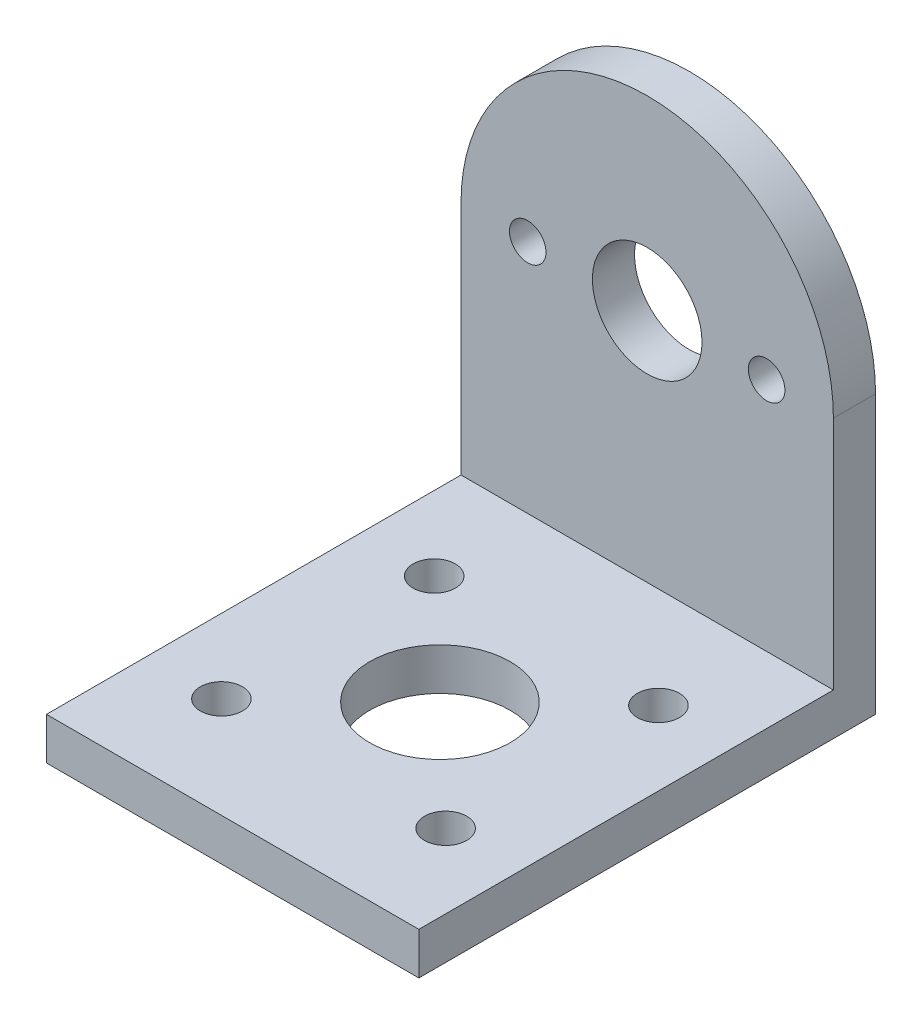
from build123d import *

# Parameters (mm, degrees)
SKETCH1_R           = 13.25
SKETCH1_R_2         = 1.3
SKETCH1_R_3         = 3.9
BOSS_EXTRUDE1_DEPTH = 3
BOSS_EXTRUDE2_DEPTH = 3


with BuildPart() as part:
    # Sketch1 → Boss-Extrude1 (new body)
    # profile 1 of 2: a face of its own
    with BuildSketch(Plane.XY):
        with Locations((0, 3.25)):
            Circle(SKETCH1_R)
        with Locations((8.5, 3.25)):
            Circle(SKETCH1_R_2, mode=Mode.SUBTRACT)
        with Locations((-8.5, 3.25)):
            Circle(SKETCH1_R_2, mode=Mode.SUBTRACT)
        with Locations((0, 3.25)):
            Circle(SKETCH1_R_3, mode=Mode.SUBTRACT)
    # profile 2 of 2: a face of its own
    with BuildSketch(Plane.XY):
        with BuildLine():
            Line((-13.25, 3.249999993), (-13.25, -16.5))
            Line((-13.25, -16.5), (13.25, -16.5))
            Line((13.25, -16.5), (13.25, 3.25))
            ThreePointArc((13.25, 3.25), (4e-09, -10), (-13.25, 3.249999993))
        make_face()
    extrude(amount=BOSS_EXTRUDE1_DEPTH)

    # Sketch2 → Boss-Extrude2 (add)
    with BuildSketch(Plane.XZ.offset(16.5)):
        with BuildLine():
            Line((0, 32.5), (-13.25, 32.5))
            Line((-13.25, 32.5), (-13.25, 3))
            Line((-13.25, 3), (0, 3))
            Line((0, 3), (0, 10.178644607))
            Line((0, 10.178644607), (-6.477335786, 10.178644607))
            ThreePointArc((-6.477335786, 10.178644607), (-9.037995958, 9.117984436), (-7.977335786, 11.678644607))
            Line((-7.977335786, 11.678644607), (-7.977335786, 23.821355393))
            ThreePointArc((-7.977335786, 23.821355393), (-9.037995958, 26.382015564), (-6.477335786, 25.321355393))
            Line((-6.477335786, 25.321355393), (0, 25.321355393))
            Line((0, 25.321355393), (0, 32.5))
        make_face()
        with BuildLine():
            Line((13.25, 32.5), (0, 32.5))
            Line((0, 32.5), (0, 25.321355393))
            Line((0, 25.321355393), (6.477335786, 25.321355393))
            ThreePointArc((6.477335786, 25.321355393), (7.977335786, 26.821355393), (9.477335786, 25.321355393))
            ThreePointArc((9.477335786, 25.321355393), (9.037995958, 24.260695221), (7.977335786, 23.821355393))
            Line((7.977335786, 23.821355393), (7.977335786, 11.678644607))
            ThreePointArc((7.977335786, 11.678644607), (9.037995958, 11.239304779), (9.477335786, 10.178644607))
            ThreePointArc((9.477335786, 10.178644607), (7.977335786, 8.678644607), (6.477335786, 10.178644607))
            Line((6.477335786, 10.178644607), (0, 10.178644607))
            Line((0, 10.178644607), (0, 3))
            Line((0, 3), (13.25, 3))
            Line((13.25, 3), (13.25, 32.5))
        make_face()
        with BuildLine():
            Line((6.477335786, 25.321355393), (0, 25.321355393))
            Line((0, 25.321355393), (0, 22.75))
            ThreePointArc((0, 22.75), (3.535533906, 21.285533906), (5, 17.75))
            ThreePointArc((5, 17.75), (3.535533906, 14.214466094), (0, 12.75))
            Line((0, 12.75), (0, 10.178644607))
            Line((0, 10.178644607), (6.477335786, 10.178644607))
            ThreePointArc((6.477335786, 10.178644607), (6.916675614, 11.239304779), (7.977335786, 11.678644607))
            Line((7.977335786, 11.678644607), (7.977335786, 23.821355393))
            ThreePointArc((7.977335786, 23.821355393), (6.916675614, 24.260695221), (6.477335786, 25.321355393))
        make_face()
        with BuildLine():
            Line((0, 22.75), (0, 25.321355393))
            Line((0, 25.321355393), (-6.477335786, 25.321355393))
            ThreePointArc((-6.477335786, 25.321355393), (-6.916675614, 24.260695221), (-7.977335786, 23.821355393))
            Line((-7.977335786, 23.821355393), (-7.977335786, 11.678644607))
            ThreePointArc((-7.977335786, 11.678644607), (-6.916675614, 11.239304779), (-6.477335786, 10.178644607))
            Line((-6.477335786, 10.178644607), (0, 10.178644607))
            Line((0, 10.178644607), (0, 12.75))
            ThreePointArc((0, 12.75), (-5, 17.75), (0, 22.75))
        make_face()
    extrude(amount=-BOSS_EXTRUDE2_DEPTH)


solid = part.part
